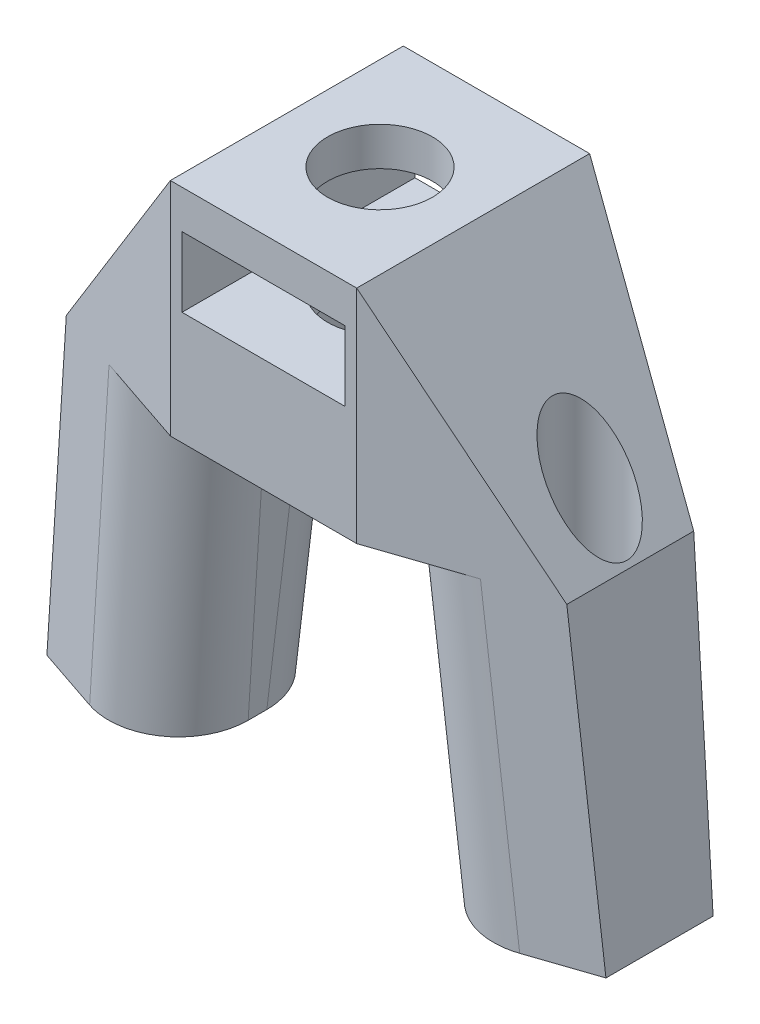
from build123d import *

# Parameters (mm, degrees)
JOINT_BODY_DEPTH      = 5
JOINT_BODY_DEPTH_BACK = 5
ESQUISSE1_W           = 8
ESQUISSE1_H           = 6.5
ESQUISSE2_R           = 3.7
BEARINGHOLE_DEPTH     = 3.2
ESQUISSE4_W           = 8
ESQUISSE4_H           = 10
LOCKEREXTRUDE_DEPTH   = 3
ESQUISSE5_R           = 2.25
AXEHOLE_DEPTH         = 16
ESQUISSE6_W           = 7
ESQUISSE6_H           = 3
LOCKERHOLE_DEPTH      = 16
FIXATIONEXTRUDE_START = -5
FIXATIONEXTRUDE_DEPTH = 10
ESQUISSE8_R           = 1.6
FIXATIONHOLE_DEPTH    = 19.5
FIXATIONPROFILE_DEPTH = 27.419689627
CONG_1_R              = 3


with BuildPart() as part:
    # Esquisse1 → Joint body (new, two sides: drawn at the far end of the back side and taken through both)
    with BuildSketch(Plane.XY.offset(-JOINT_BODY_DEPTH_BACK)):
        with Locations((0, 10.463867403)):
            Rectangle(ESQUISSE1_W, ESQUISSE1_H)
    extrude(amount=JOINT_BODY_DEPTH + JOINT_BODY_DEPTH_BACK)

    # Esquisse2 → BearingHole (cut)
    with BuildSketch(Plane.XZ.offset(-7.213867403)):
        with Locations(Location((0, 0, 0), (0, 0, 270))):
            Circle(ESQUISSE2_R)
    extrude(amount=-BEARINGHOLE_DEPTH, mode=Mode.SUBTRACT)

    # Esquisse4 → LockerExtrude (add)
    with BuildSketch(Plane(origin=(0, 13.713867403, 0), x_dir=(1, 0, 0), z_dir=(0, 1, 0))):
        Rectangle(ESQUISSE4_W, ESQUISSE4_H)
    extrude(amount=LOCKEREXTRUDE_DEPTH)

    # Esquisse5 → AxeHole (cut)
    with BuildSketch(Plane(origin=(0, 16.713867403, 0), x_dir=(1, 0, 0), z_dir=(0, 1, 0))):
        with Locations(Location((0, 0, 0), (0, 0, 270))):
            Circle(ESQUISSE5_R)
    extrude(amount=-AXEHOLE_DEPTH, mode=Mode.SUBTRACT)

    # Esquisse6 → LockerHole (cut)
    with BuildSketch(Plane.XY.offset(5)):
        with Locations((0, 13.563867403)):
            Rectangle(ESQUISSE6_W, ESQUISSE6_H)
    extrude(amount=-LOCKERHOLE_DEPTH, mode=Mode.SUBTRACT)

    # Esquisse7 → FixationExtrude (add)
    with BuildSketch(Plane.XY.offset(FIXATIONEXTRUDE_START)):
        Polygon((12, -6.286132597), (10.743640135, 7.188023114), (4, 16.713867403), (4, 7.213867403), (5.258769643, -6.286132597), align=None)
    fixationextrude = extrude(amount=FIXATIONEXTRUDE_DEPTH)

    # Esquisse8 → FixationHole (cut)
    with BuildSketch(Plane.XZ.offset(6.286132597)):
        with Locations((9, 0)):
            Circle(ESQUISSE8_R)
    fixationhole = extrude(amount=-FIXATIONHOLE_DEPTH, mode=Mode.SUBTRACT)

    # Esquisse10 → FixationProfile (cut, through all)
    with BuildSketch(Plane.XZ.offset(6.286132597)):
        Polygon((12, 2.3), (12, 5), (4, 5), align=None)
        Polygon((12, -2.3), (12, -5), (4, -5), align=None)
    fixationprofile = extrude(amount=-FIXATIONPROFILE_DEPTH, mode=Mode.SUBTRACT)

    # Symétrie3: FixationExtrude, FixationHole, FixationProfile across plane
    add(fixationextrude.mirror(Plane(origin=(0, 0, 0), x_dir=(0, 0, 1), z_dir=(1, 0, 0))))
    add(fixationhole.mirror(Plane(origin=(0, 0, 0), x_dir=(0, 0, 1), z_dir=(1, 0, 0))), mode=Mode.SUBTRACT)
    add(fixationprofile.mirror(Plane(origin=(0, 0, 0), x_dir=(0, 0, 1), z_dir=(1, 0, 0))), mode=Mode.SUBTRACT)

    # Congé1
    cong_1_edges = [part.edges().sort_by_distance(p)[0] for p in [
        (-4.629384821, 0.463867403, -4.787582623),
        (-4.629384821, 0.463867403, 4.787582623),
        (4.629384821, 0.463867403, 4.787582623),
        (4.629384821, 0.463867403, -4.787582623),
    ]]
    fillet(cong_1_edges, radius=CONG_1_R)


solid = part.part
